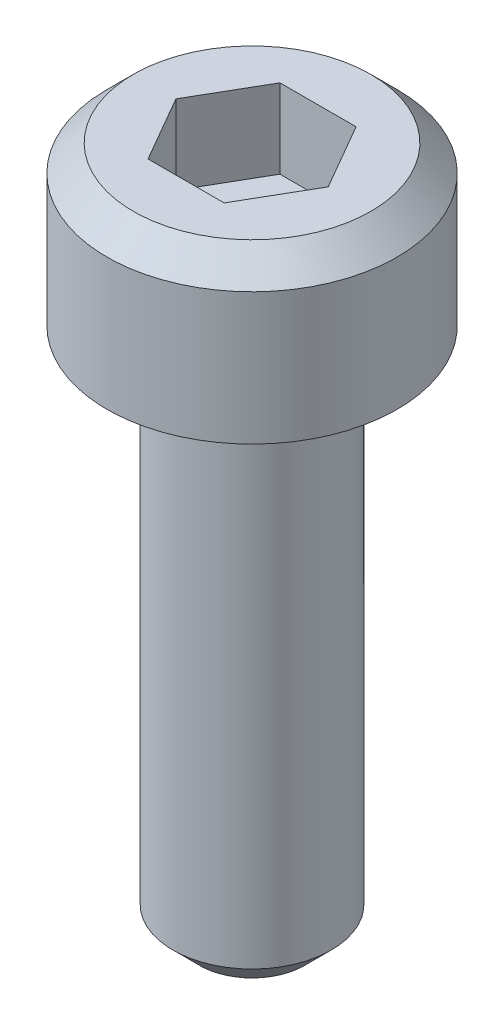
from build123d import *

# Parameters (mm, degrees)
CUT_EXTRUDE1_DEPTH = 1.5


with BuildPart() as part:
    # Sketch1 → Revolve1 (revolve)
    with BuildSketch(Plane.XY, mode=Mode.PRIVATE) as revolve1_sk:
        Polygon((0, 13), (-2.25, 13), (-2.75, 12.5), (-2.75, 10), (-1.5, 10), (-1.5, 0.5), (-1, 0), (0, 0), align=None)
    revolve(revolve1_sk.sketch.rotate(Axis((0, 0, 0), (0, 1, 0)), 270), axis=Axis((0, 0, 0), (0, 1, 0)))

    # Sketch2 → Cut-Extrude1 (cut)
    with BuildSketch(Plane(origin=(0, 13, 0), x_dir=(1, 0, 0), z_dir=(0, 1, 0))):
        Polygon((-1.443375673, 0), (-0.721687836, -1.25), (0.721687836, -1.25), (1.443375673, 0), (0.721687836, 1.25), (-0.721687836, 1.25), align=None)
    extrude(amount=-CUT_EXTRUDE1_DEPTH, mode=Mode.SUBTRACT)


solid = part.part
